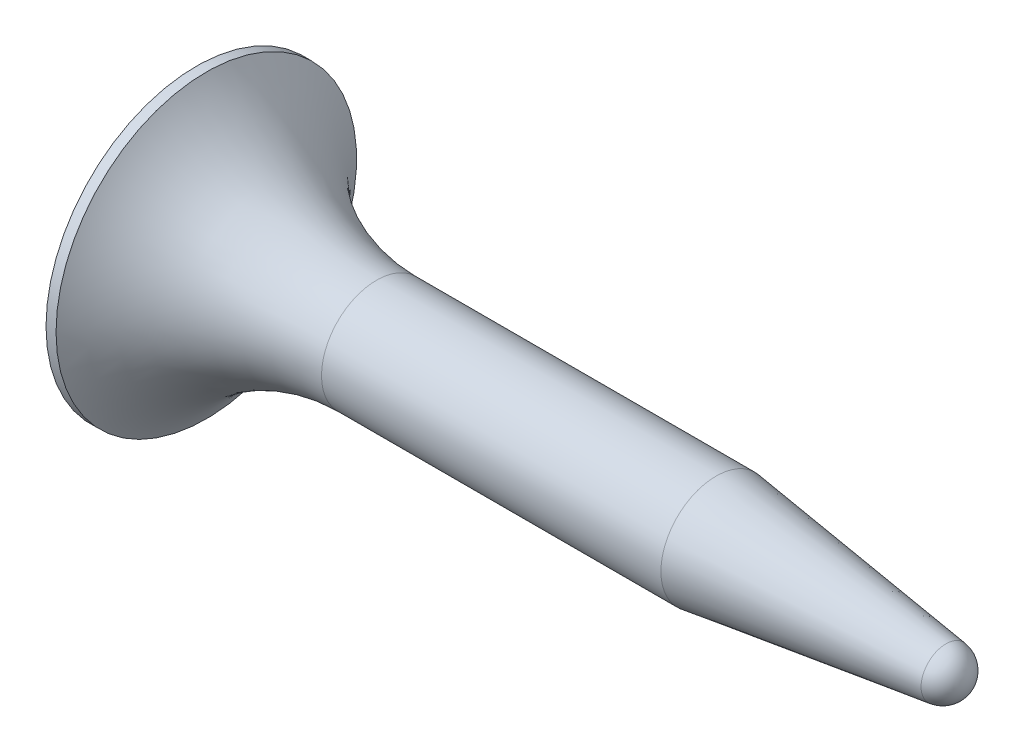
from build123d import *


with BuildPart() as part:
    # Sketch1 → Revolve1 (revolve)
    with BuildSketch(Plane.XY, mode=Mode.PRIVATE) as revolve1_sk:
        with BuildLine():
            Line((0, -3.81), (0, 0))
            Line((0, 0), (19.558, 0))
            ThreePointArc((19.558, 0), (19.400418278, -0.418684593), (19.005884132, -0.629567487))
            Line((19.005884132, -0.629567487), (13.176655465, -1.397))
            Line((13.176655465, -1.397), (4.572, -1.397))
            ThreePointArc((4.572, -1.397), (2.098758554, -2.041173202), (0.254, -3.81))
            Line((0.254, -3.81), (0, -3.81))
        make_face()
    revolve(revolve1_sk.sketch.rotate(Axis((0, 0, 0), (1, 0, 0)), 270), axis=Axis((0, 0, 0), (1, 0, 0)))


solid = part.part
